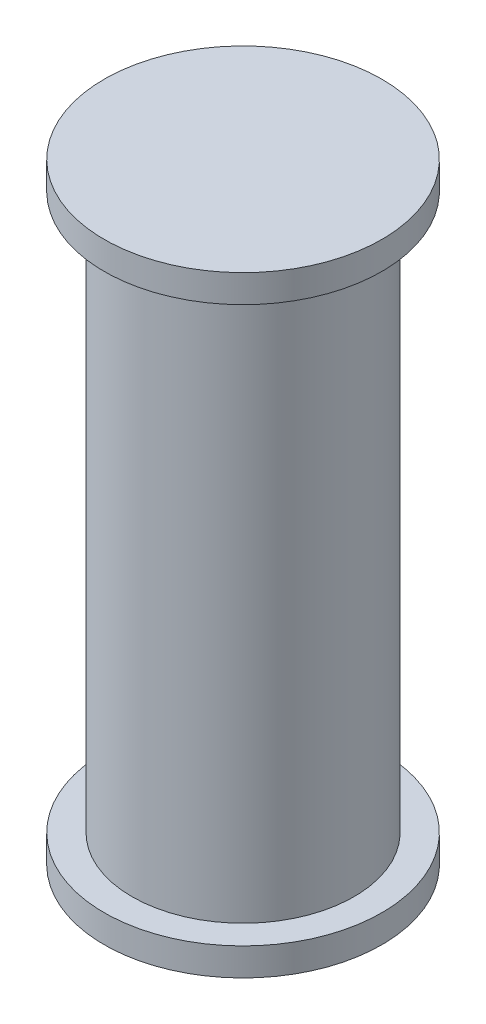
from build123d import *


with BuildPart() as part:
    # Sketch1 → Revolve1 (revolve)
    with BuildSketch(Plane.YZ, mode=Mode.PRIVATE) as revolve1_sk:
        Polygon((-10, 4), (10, 4), (10, 5), (11, 5), (11, 0), (-11, 0), (-11, 5), (-10, 5), align=None)
    revolve(revolve1_sk.sketch.rotate(Axis((0, -12.073424176, 0), (0, 1, 0)), 180), axis=Axis((0, -12.073424176, 0), (0, 1, 0)))


solid = part.part
